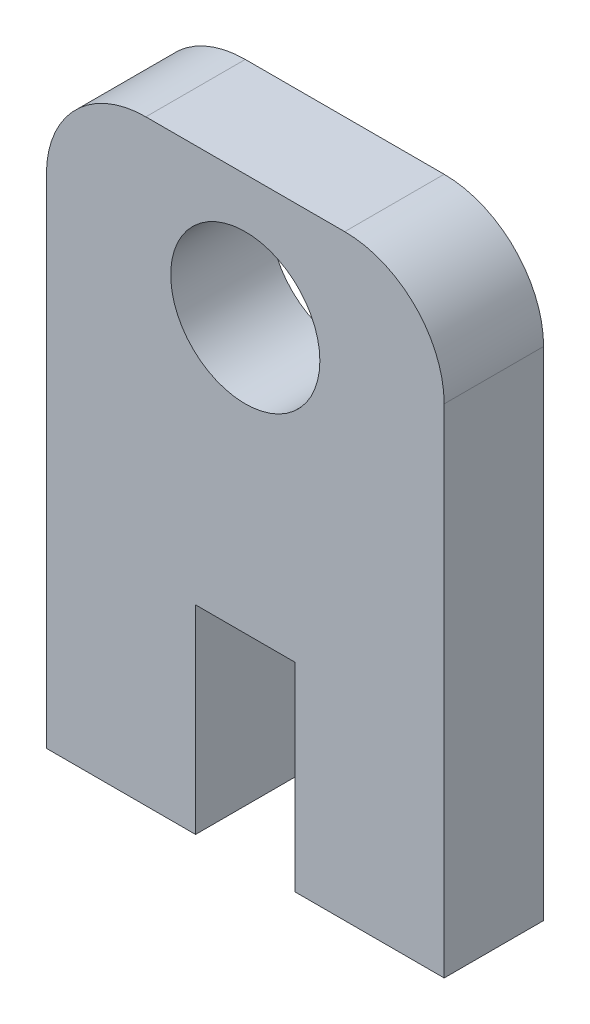
from build123d import *

# Parameters (mm, degrees)
SKETCH1_R           = 2.38125
BOSS_EXTRUDE1_DEPTH = 3.175


with BuildPart() as part:
    # Sketch1 → Boss-Extrude1 (new body)
    with BuildSketch(Plane.XY):
        with BuildLine():
            Line((182.391318128, -1.5875), (176.041318128, -1.5875))
            ThreePointArc((176.041318128, -1.5875), (173.796254098, -2.51743597), (172.866318128, -4.7625))
            Line((172.866318128, -4.7625), (172.866318128, -20.6375))
            Line((172.866318128, -20.6375), (177.628818128, -20.6375))
            Line((177.628818128, -20.6375), (177.628818128, -14.2875))
            Line((177.628818128, -14.2875), (180.803818128, -14.2875))
            Line((180.803818128, -14.2875), (180.803818128, -20.6375))
            Line((180.803818128, -20.6375), (185.566318128, -20.6375))
            Line((185.566318128, -20.6375), (185.566318128, -4.7625))
            ThreePointArc((185.566318128, -4.7625), (184.636382159, -2.51743597), (182.391318128, -1.5875))
        make_face()
        with Locations((179.216318128, -5.55625)):
            Circle(SKETCH1_R, mode=Mode.SUBTRACT)
    extrude(amount=BOSS_EXTRUDE1_DEPTH)


solid = part.part
